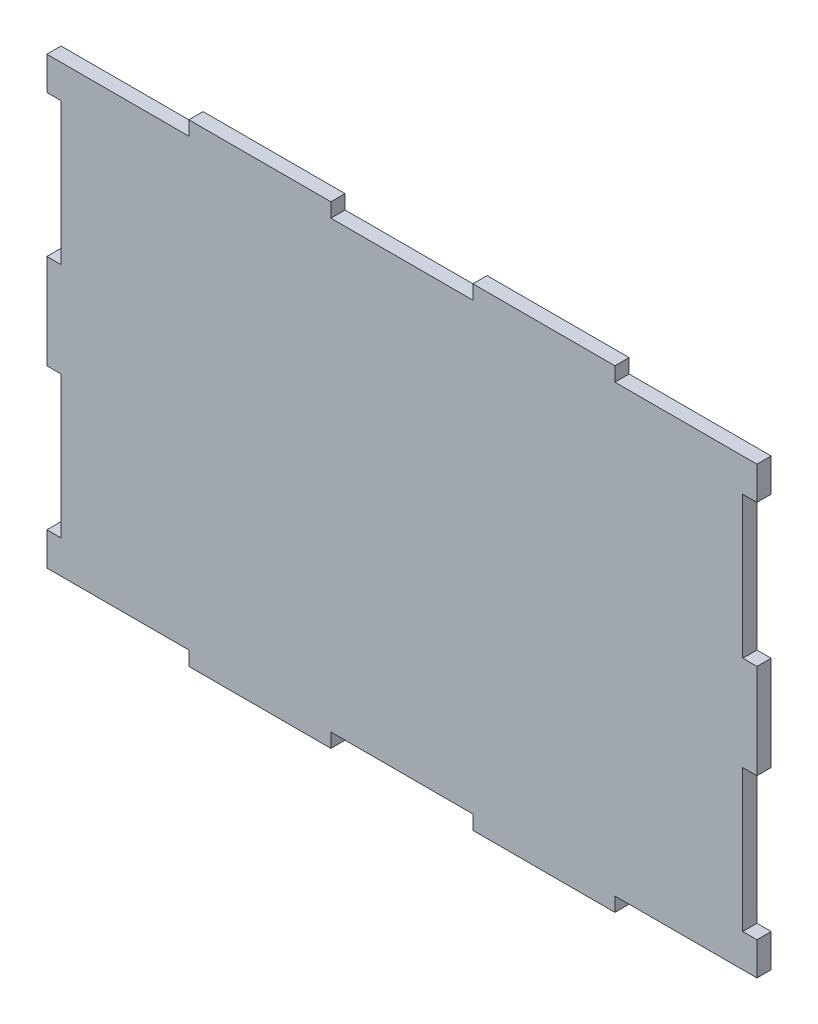
from build123d import *

# Parameters (mm, degrees)
BOSS_EXTRU_1_DEPTH = 3


with BuildPart() as part:
    # Esquisse1 → Boss.-Extru.1 (new body)
    with BuildSketch(Plane.XY):
        Polygon((71.175872824, -27.390104167), (71.175872824, -7.390104167), (68.175872824, -7.390104167), (68.175872824, 22.609895833), (71.175872824, 22.609895833), (71.175872824, 29.609895833), (41.175872824, 29.609895833), (41.175872824, 32.609895833), (11.175872824, 32.609895833), (11.175872824, 29.609895833), (-18.824127176, 29.609895833), (-18.824127176, 32.609895833), (-48.824127176, 32.609895833), (-48.824127176, 29.609895833), (-78.824127176, 29.609895833), (-78.824127176, 22.609895833), (-75.824127176, 22.609895833), (-75.824127176, -7.390104167), (-78.824127176, -7.390104167), (-78.824127176, -27.390104167), (-75.824127176, -27.390104167), (-75.824127176, -57.390104167), (-78.824127176, -57.390104167), (-78.824127176, -64.390104167), (-48.824127176, -64.390104167), (-48.824127176, -67.390104167), (-18.824127176, -67.390104167), (-18.824127176, -64.390104167), (11.175872824, -64.390104167), (11.175872824, -67.390104167), (41.175872824, -67.390104167), (41.175872824, -64.390104167), (71.175872824, -64.390104167), (71.175872824, -57.390104167), (68.175872824, -57.390104167), (68.175872824, -27.390104167), align=None)
    extrude(amount=BOSS_EXTRU_1_DEPTH)


solid = part.part
